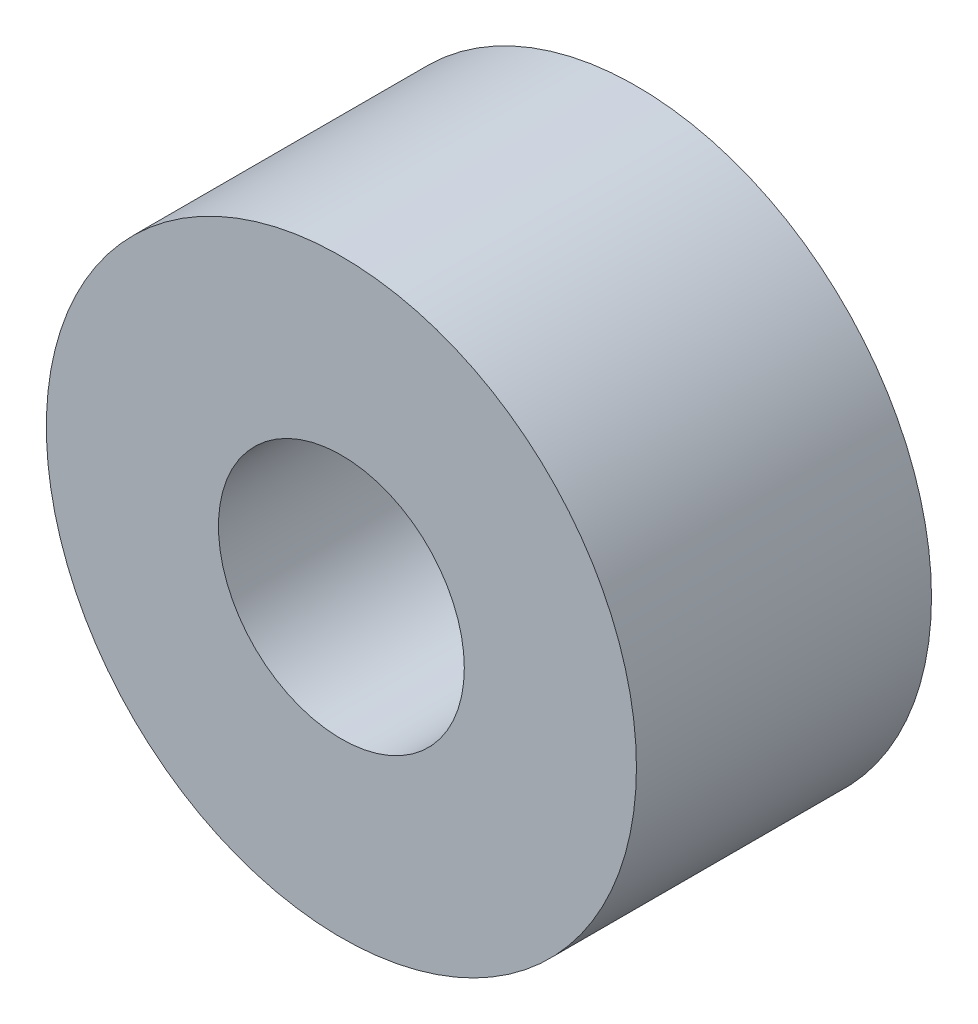
from build123d import *

# Parameters (mm, degrees)
SKETCH1_R           = 3
SKETCH1_R_2         = 1.25
BOSS_EXTRUDE1_DEPTH = 3


with BuildPart() as part:
    # Sketch1 → Boss-Extrude1 (new body)
    with BuildSketch(Plane.XY):
        Circle(SKETCH1_R)
        Circle(SKETCH1_R_2, mode=Mode.SUBTRACT)
    extrude(amount=BOSS_EXTRUDE1_DEPTH)


solid = part.part
